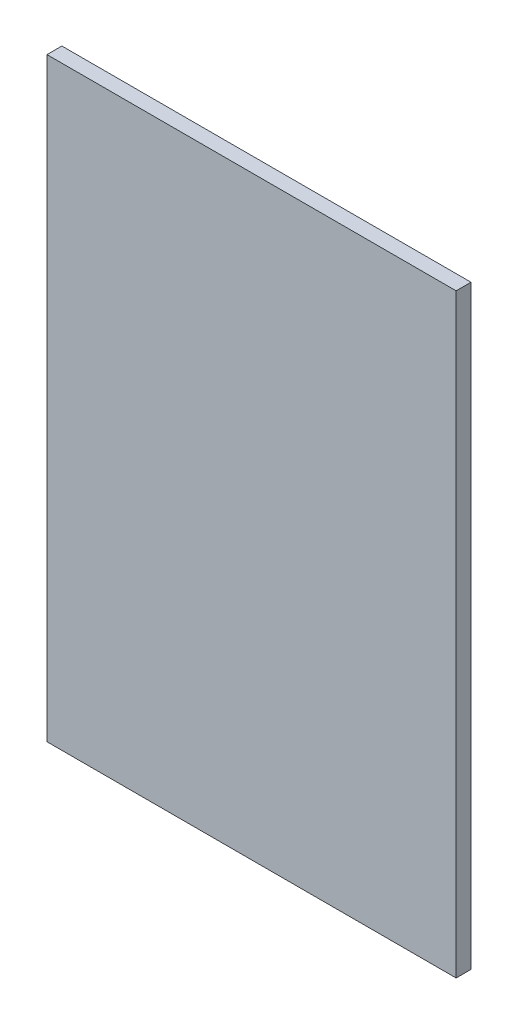
from build123d import *

# Parameters (mm, degrees)
ESQUISSE1_W        = 165
ESQUISSE1_H        = 240
BOSS_EXTRU_1_DEPTH = 6


with BuildPart() as part:
    # Esquisse1 → Boss.-Extru.1 (new body)
    with BuildSketch(Plane.XY):
        with Locations((-82.5, 120)):
            Rectangle(ESQUISSE1_W, ESQUISSE1_H)
    extrude(amount=BOSS_EXTRU_1_DEPTH)


solid = part.part
